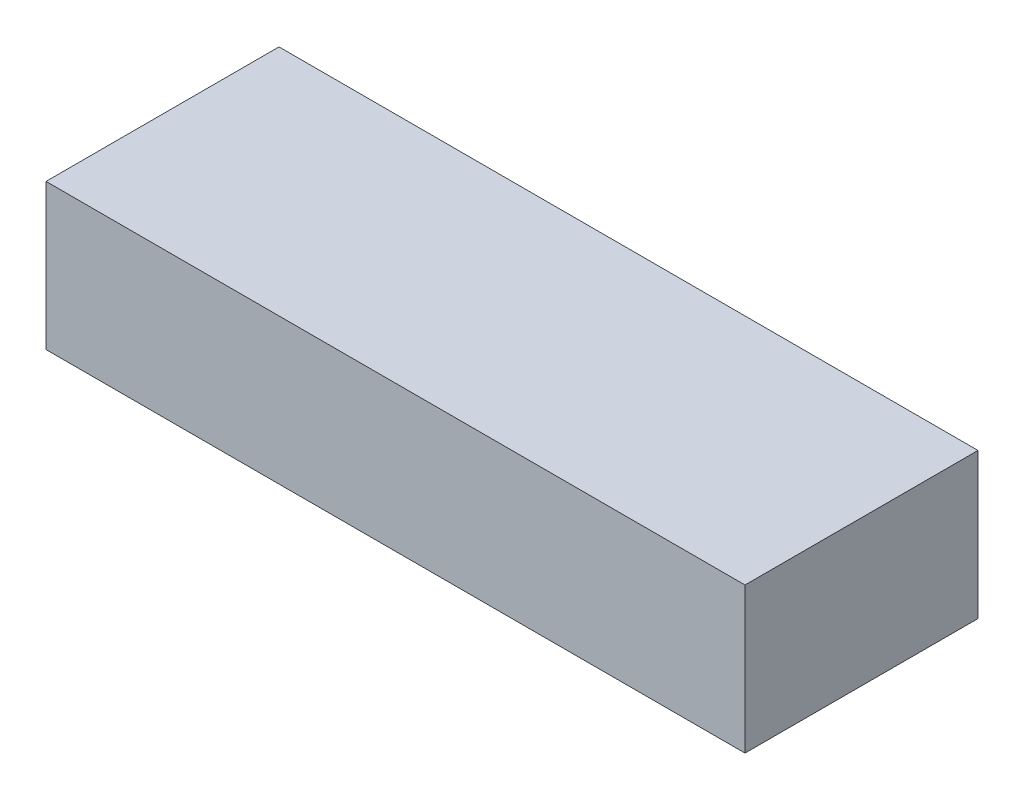
from build123d import *

# Parameters (mm, degrees)
SKETCH1_W      = 120
SKETCH1_H      = 40
EXTRUDE1_DEPTH = 25


with BuildPart() as part:
    # Sketch1 → Extrude1 (new body)
    with BuildSketch(Plane(origin=(0, 0, 0), x_dir=(1, 0, 0), z_dir=(0, 1, 0))):
        Rectangle(SKETCH1_W, SKETCH1_H)
    extrude(amount=EXTRUDE1_DEPTH)


solid = part.part
